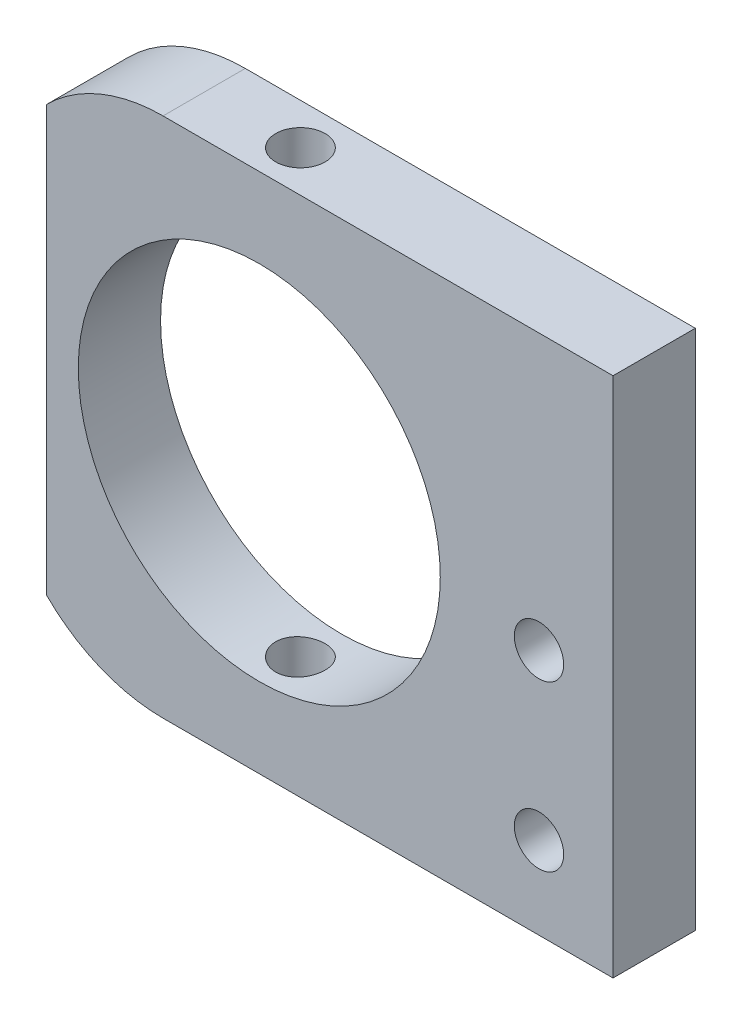
from build123d import *

# Parameters (mm, degrees)
MODEL_R                 = 11
MODEL_R_2               = 1.5
SALIENTE_EXTRUIR1_DEPTH = 5
CROQUIS2_R              = 1.5
CORTAR_EXTRUIR1_DEPTH   = 35


with BuildPart() as part:
    # Model → Saliente-Extruir1 (new body)
    with BuildSketch(Plane.XY):
        with BuildLine():
            Line((112.251450395, 91.173573784), (133.951450395, 91.173573784))
            Line((133.951450395, 91.173573784), (139.601450395, 91.173573784))
            Line((139.601450395, 91.173573784), (139.601450395, 122.873573784))
            Line((139.601450395, 122.873573784), (133.951450395, 122.873573784))
            Line((133.951450395, 122.873573784), (112.251450395, 122.873573784))
            ThreePointArc((112.251450395, 122.873573784), (108.424616072, 122.112369109), (105.180382583, 119.944641596))
            Line((105.180382583, 119.944641596), (105.180382583, 94.102505972))
            ThreePointArc((105.180382583, 94.102505972), (108.424616072, 91.934778459), (112.251450395, 91.173573784))
        make_face()
        with Locations((118.101450395, 107.023573784)):
            Circle(MODEL_R, mode=Mode.SUBTRACT)
        with Locations((135.101450395, 106.173573784)):
            Circle(MODEL_R_2, mode=Mode.SUBTRACT)
        with Locations((135.101450395, 96.173573784)):
            Circle(MODEL_R_2, mode=Mode.SUBTRACT)
    extrude(amount=SALIENTE_EXTRUIR1_DEPTH)

    # Croquis2 → Cortar-Extruir1 (cut)
    with BuildSketch(Plane.XZ.offset(-91.173573784)):
        with Locations(Location((118.101450395, 2.5, 0), (0, 0, 270))):
            Circle(CROQUIS2_R)
    extrude(amount=-CORTAR_EXTRUIR1_DEPTH, mode=Mode.SUBTRACT)


solid = part.part
